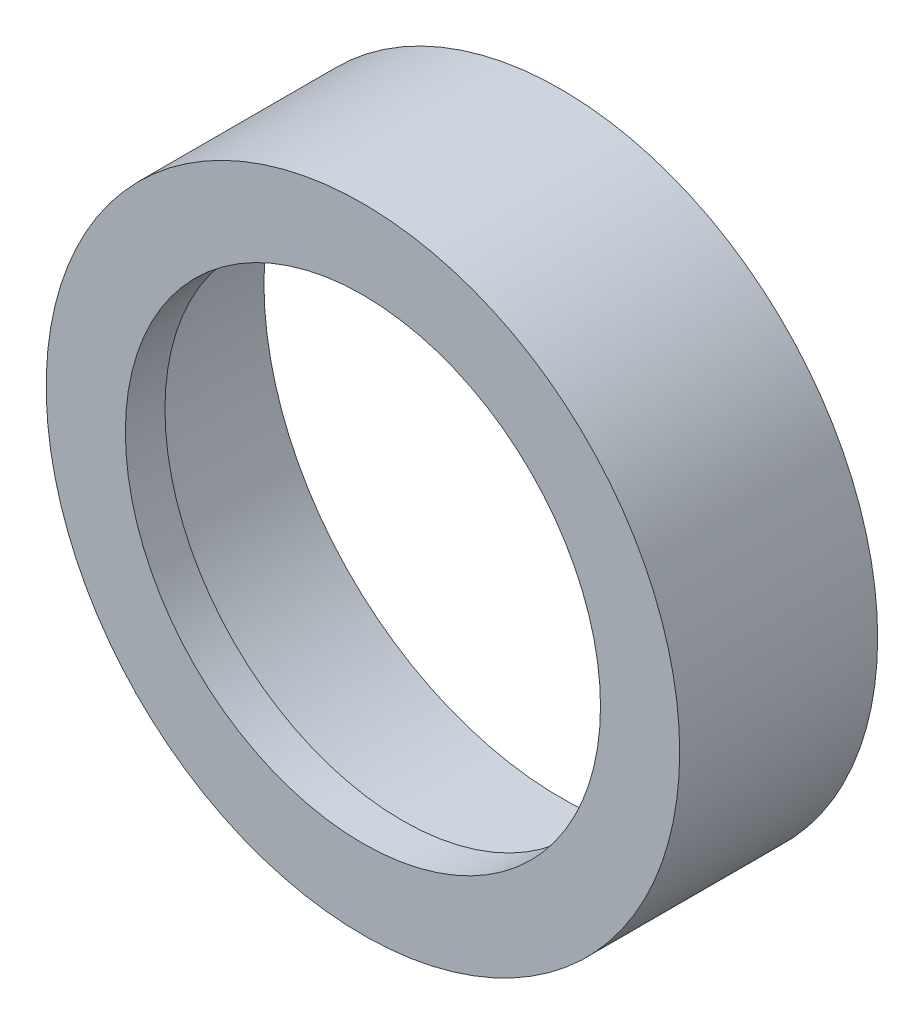
from build123d import *

# Parameters (mm, degrees)
SKETCH1_R           = 40
SKETCH1_R_2         = 37.5
BOSS_EXTRUDE1_DEPTH = 25
SKETCH2_R           = 37.5
SKETCH2_R_2         = 30
BOSS_EXTRUDE3_DEPTH = 5


with BuildPart() as part:
    # Sketch1 → Boss-Extrude1 (new body)
    with BuildSketch(Plane.XY):
        Circle(SKETCH1_R)
        Circle(SKETCH1_R_2, mode=Mode.SUBTRACT)
    extrude(amount=-BOSS_EXTRUDE1_DEPTH)

    # Sketch2 → Boss-Extrude3 (add)
    with BuildSketch(Plane(origin=(0, 0, 0), x_dir=(-1, 0, 0), z_dir=(0, 0, -1))):
        with Locations(Location((0, 0, 0), (0, 0, 180))):
            Circle(SKETCH2_R)
        Circle(SKETCH2_R_2, mode=Mode.SUBTRACT)
    extrude(amount=BOSS_EXTRUDE3_DEPTH)


solid = part.part
